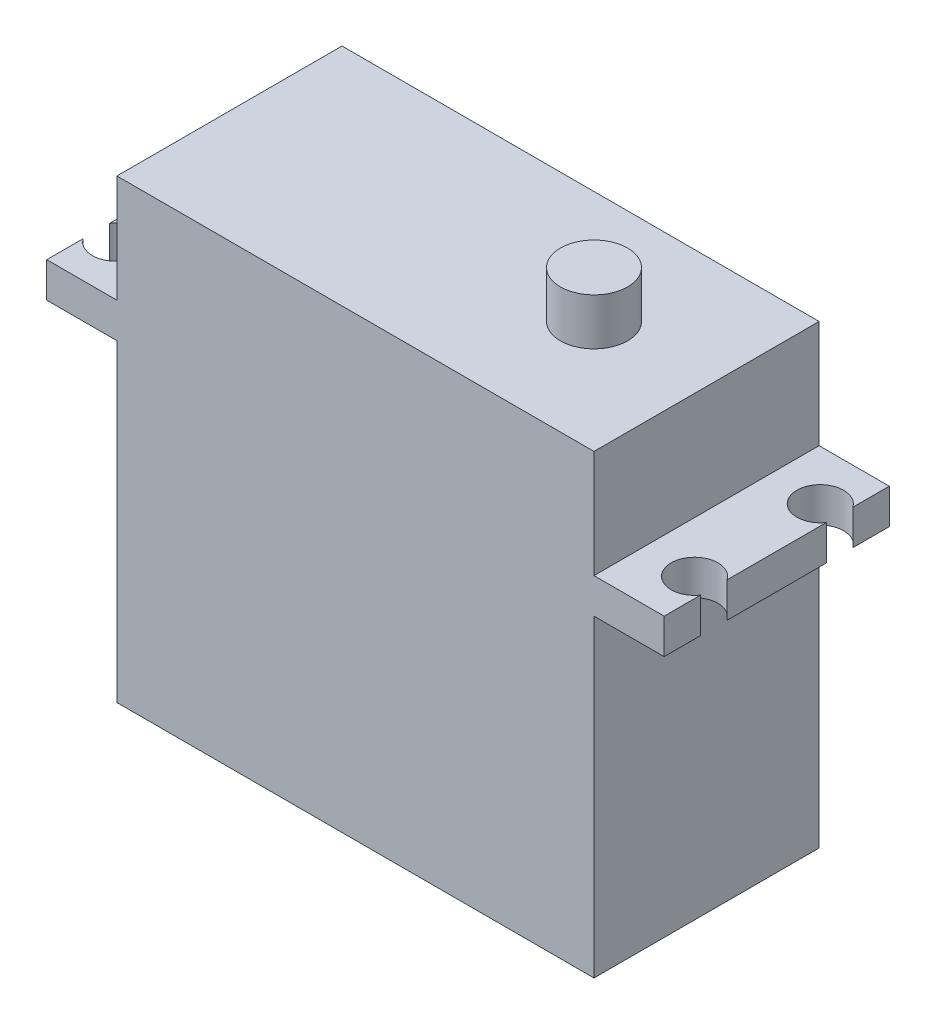
from build123d import *

# Parameters (mm, degrees)
BOSS_EXTRUDE1_DEPTH = 19.25
SKETCH2_R           = 2.875
BOSS_EXTRUDE2_DEPTH = 4
CUT_EXTRUDE1_REACH  = 60.727
SKETCH3_R           = 2


with BuildPart() as part:
    # Sketch1 → Boss-Extrude1 (new body)
    with BuildSketch(Plane.XY):
        Polygon((0, 0), (40.8, 0), (40.8, 26.8), (46.8, 26.8), (46.8, 29.8), (40.8, 29.8), (40.8, 39), (0, 39), (0, 29.8), (-6, 29.8), (-6, 26.8), (0, 26.8), align=None)
    extrude(amount=BOSS_EXTRUDE1_DEPTH)

    # Sketch2 → Boss-Extrude2 (add)
    with BuildSketch(Plane(origin=(0, 39, 0), x_dir=(1, 0, 0), z_dir=(0, 1, 0))):
        with Locations((31.175, -9.625)):
            Circle(SKETCH2_R)
    extrude(amount=BOSS_EXTRUDE2_DEPTH)

    # Sketch3 → Cut-Extrude1 (cut, up to next)
    with BuildSketch(Plane(origin=(0, 29.8, 0), x_dir=(1, 0, 0), z_dir=(0, 1, 0)), mode=Mode.PRIVATE) as cut_extrude1_sk1:
        with Locations((45.15, -15)):
            Circle(SKETCH3_R)
    cut_extrude1_tool1 = extrude(cut_extrude1_sk1.sketch, amount=-CUT_EXTRUDE1_REACH, mode=Mode.PRIVATE) & part.part
    # Sketch3 → Cut-Extrude1 (cut, up to next)
    with BuildSketch(Plane(origin=(0, 29.8, 0), x_dir=(1, 0, 0), z_dir=(0, 1, 0)), mode=Mode.PRIVATE) as cut_extrude1_sk2:
        with Locations((45.15, -4.25)):
            Circle(SKETCH3_R)
    cut_extrude1_tool2 = extrude(cut_extrude1_sk2.sketch, amount=-CUT_EXTRUDE1_REACH, mode=Mode.PRIVATE) & part.part
    # Sketch3 → Cut-Extrude1 (cut, up to next)
    with BuildSketch(Plane(origin=(0, 29.8, 0), x_dir=(1, 0, 0), z_dir=(0, 1, 0)), mode=Mode.PRIVATE) as cut_extrude1_sk3:
        with Locations((-4.35, -4.25)):
            Circle(SKETCH3_R)
    cut_extrude1_tool3 = extrude(cut_extrude1_sk3.sketch, amount=-CUT_EXTRUDE1_REACH, mode=Mode.PRIVATE) & part.part
    # Sketch3 → Cut-Extrude1 (cut, up to next)
    with BuildSketch(Plane(origin=(0, 29.8, 0), x_dir=(1, 0, 0), z_dir=(0, 1, 0)), mode=Mode.PRIVATE) as cut_extrude1_sk4:
        with Locations((-4.35, -15)):
            Circle(SKETCH3_R)
    cut_extrude1_tool4 = extrude(cut_extrude1_sk4.sketch, amount=-CUT_EXTRUDE1_REACH, mode=Mode.PRIVATE) & part.part
    add(cut_extrude1_tool1.solids().sort_by_distance((45.15, 29.8, 15))[0], mode=Mode.SUBTRACT)
    add(cut_extrude1_tool2.solids().sort_by_distance((45.15, 29.8, 4.25))[0], mode=Mode.SUBTRACT)
    add(cut_extrude1_tool3.solids().sort_by_distance((-4.35, 29.8, 4.25))[0], mode=Mode.SUBTRACT)
    add(cut_extrude1_tool4.solids().sort_by_distance((-4.35, 29.8, 15))[0], mode=Mode.SUBTRACT)


solid = part.part
